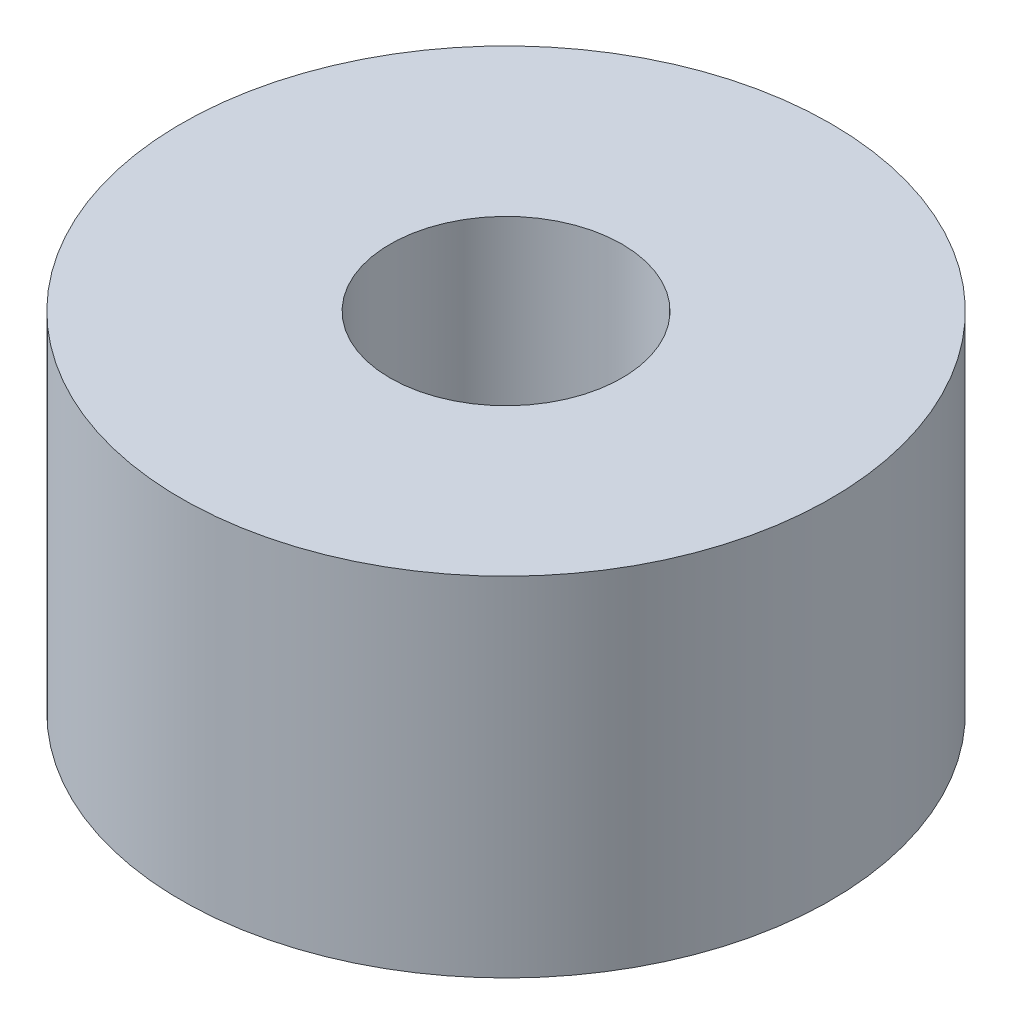
from build123d import *

# Parameters (mm, degrees)
SKETCH1_R           = 8.89
SKETCH1_R_2         = 3.175
BOSS_EXTRUDE1_DEPTH = 9.525


with BuildPart() as part:
    # Sketch1 → Boss-Extrude1 (new body)
    with BuildSketch(Plane(origin=(0, 0, 0), x_dir=(1, 0, 0), z_dir=(0, 1, 0))):
        with Locations(Location((0, 0, 0), (0, 0, 90))):
            Circle(SKETCH1_R)
        with Locations(Location((0, 0, 0), (0, 0, 90))):
            Circle(SKETCH1_R_2, mode=Mode.SUBTRACT)
    extrude(amount=BOSS_EXTRUDE1_DEPTH)


solid = part.part
